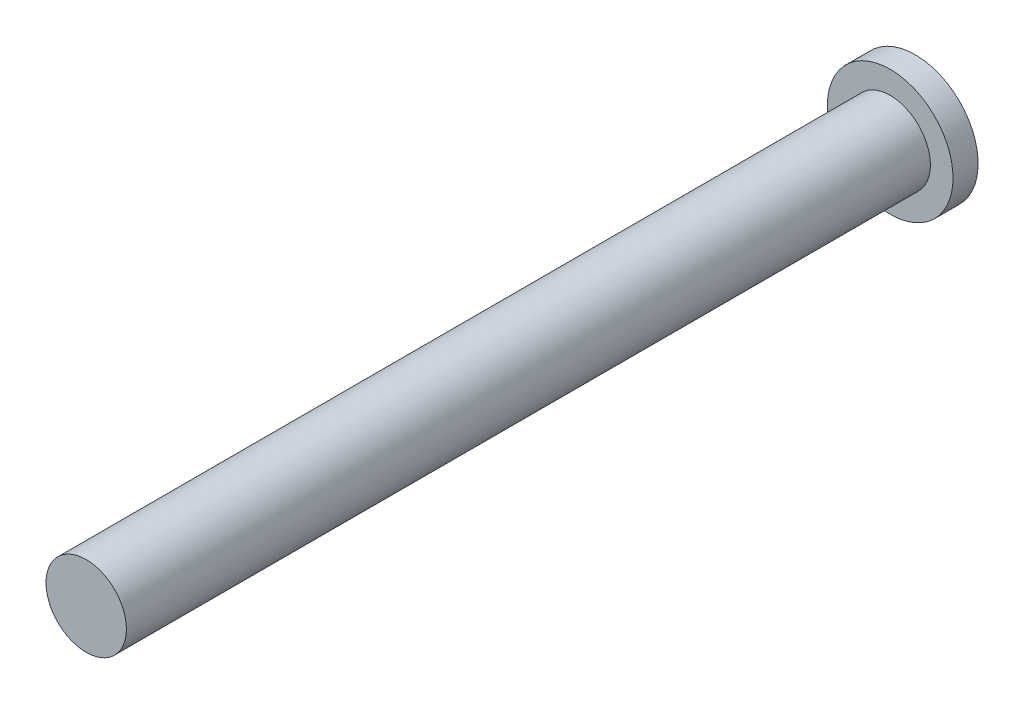
from build123d import *

# Parameters (mm, degrees)
SKETCH2_R           = 1.6
BOSS_EXTRUDE1_DEPTH = 32
SKETCH4_R           = 2.5
BOSS_EXTRUDE2_DEPTH = 1


with BuildPart() as part:
    # Sketch2 → Boss-Extrude1 (new body)
    with BuildSketch(Plane.XY):
        Circle(SKETCH2_R)
    extrude(amount=BOSS_EXTRUDE1_DEPTH)

    # Sketch4 → Boss-Extrude2 (add)
    with BuildSketch(Plane(origin=(0, 0, 0), x_dir=(-1, 0, 0), z_dir=(0, 0, -1))):
        Circle(SKETCH4_R)
    extrude(amount=BOSS_EXTRUDE2_DEPTH)


solid = part.part
